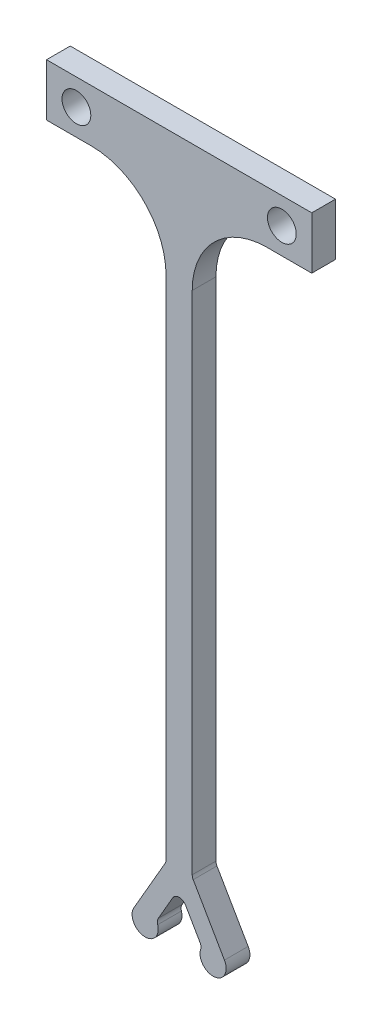
from build123d import *

# Parameters (mm, degrees)
SKETCH1_R           = 1.925
BOSS_EXTRUDE1_DEPTH = 3.175


with BuildPart() as part:
    # Sketch1 → Boss-Extrude1 (new body)
    with BuildSketch(Plane.XY):
        with BuildLine():
            Line((1.75, 90.718911087), (17.75, 90.718911087))
            Line((17.75, 90.718911087), (17.75, 83.718911087))
            Line((17.75, 83.718911087), (11.75, 83.718911087))
            ThreePointArc((11.75, 83.718911087), (4.678932188, 80.789978899), (1.75, 73.718911087))
            Line((1.75, 73.718911087), (1.75, 5.986860279))
            ThreePointArc((1.75, 5.986860279), (1.784074174, 5.728041234), (1.883974596, 5.486860279))
            Line((1.883974596, 5.486860279), (6.062177826, -1.75))
            ThreePointArc((6.062177826, -1.75), (4.744524835, -4.363775134), (2.873226135, -2.112937283))
            ThreePointArc((2.873226135, -2.112937283), (2.91057922, -1.707249179), (2.783018833, -1.320330017))
            Line((2.783018833, -1.320330017), (0.866025404, 2))
            ThreePointArc((0.866025404, 2), (0, 2.5), (-0.866025404, 2))
            Line((-0.866025404, 2), (-2.783018833, -1.320330017))
            ThreePointArc((-2.783018833, -1.320330017), (-2.91057922, -1.707249179), (-2.873226135, -2.112937283))
            ThreePointArc((-2.873226135, -2.112937283), (-4.744524835, -4.363775134), (-6.062177826, -1.75))
            Line((-6.062177826, -1.75), (-1.883974596, 5.486860279))
            ThreePointArc((-1.883974596, 5.486860279), (-1.784074174, 5.728041234), (-1.75, 5.986860279))
            Line((-1.75, 5.986860279), (-1.75, 73.718911087))
            ThreePointArc((-1.75, 73.718911087), (-4.678932188, 80.789978899), (-11.75, 83.718911087))
            Line((-11.75, 83.718911087), (-17.75, 83.718911087))
            Line((-17.75, 83.718911087), (-17.75, 90.718911087))
            Line((-17.75, 90.718911087), (-1.75, 90.718911087))
            Line((-1.75, 90.718911087), (1.75, 90.718911087))
        make_face()
        with Locations((-13.75, 87.218911087)):
            Circle(SKETCH1_R, mode=Mode.SUBTRACT)
        with Locations((13.75, 87.218911087)):
            Circle(SKETCH1_R, mode=Mode.SUBTRACT)
    extrude(amount=BOSS_EXTRUDE1_DEPTH)


solid = part.part
